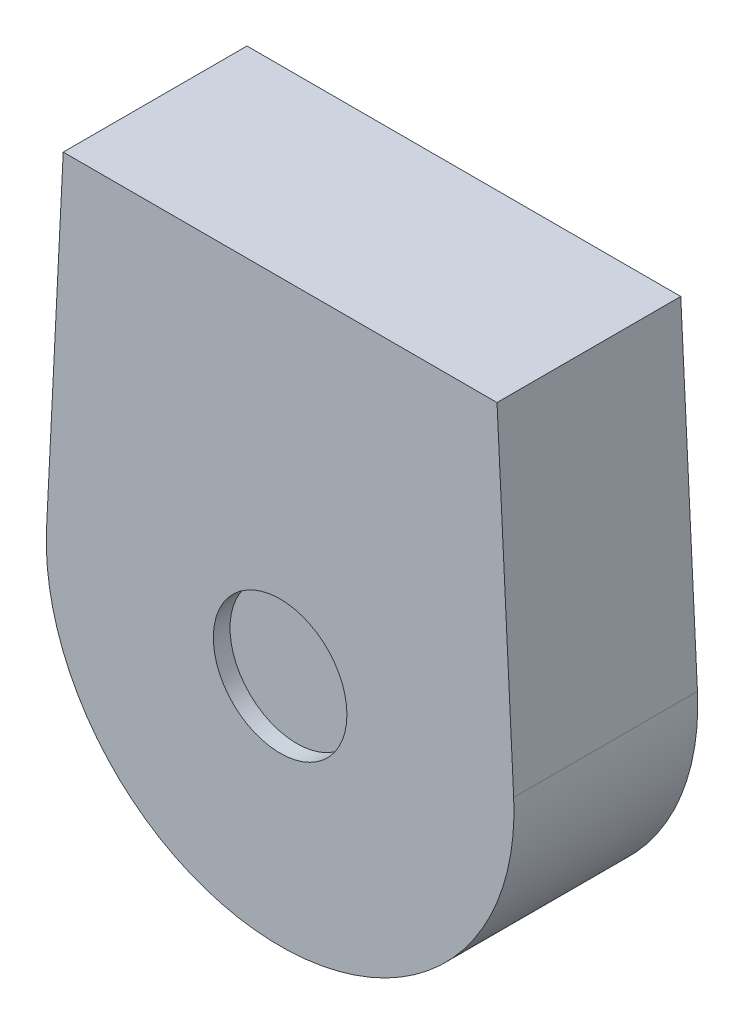
from build123d import *

# Parameters (mm, degrees)
BOSS_EXTRUDE1_DEPTH      = 13.97
BOSS_EXTRUDE1_DEPTH_BACK = 13.97
SKETCH3_R                = 10.16
CUT_EXTRUDE1_DEPTH       = 2.54
SKETCH5_W                = 7.720577833
SKETCH5_H                = 11.69140021
CUT_EXTRUDE3_DEPTH       = 22.098


with BuildPart() as part:
    # Sketch2 → Boss-Extrude1 (new, two sides: drawn at the far end of the back side and taken through both)
    with BuildSketch(Plane.XY.offset(-BOSS_EXTRUDE1_DEPTH_BACK)):
        with BuildLine():
            Line((-35.51563317, 1.775781659), (-32.97880223, 52.512400474))
            Line((-32.97880223, 52.512400474), (32.97880223, 52.512400474))
            Line((32.97880223, 52.512400474), (35.51563317, 1.775781659))
            ThreePointArc((35.51563317, 1.775781659), (0, -35.56), (-35.51563317, 1.775781659))
        make_face()
    extrude(amount=BOSS_EXTRUDE1_DEPTH + BOSS_EXTRUDE1_DEPTH_BACK)

    # Sketch3 → Cut-Extrude1 (cut)
    with BuildSketch(Plane.XY.offset(13.97)):
        Circle(SKETCH3_R)
    extrude(amount=-CUT_EXTRUDE1_DEPTH, mode=Mode.SUBTRACT)

    # Sketch5 → Cut-Extrude3 (cut)
    with BuildSketch(Plane(origin=(0, 0, -13.97), x_dir=(-1, 0, 0), z_dir=(0, 0, -1))):
        with Locations((14.585332616, -1.114418504)):
            Rectangle(SKETCH5_W, SKETCH5_H)
    extrude(amount=-CUT_EXTRUDE3_DEPTH, mode=Mode.SUBTRACT)


solid = part.part
